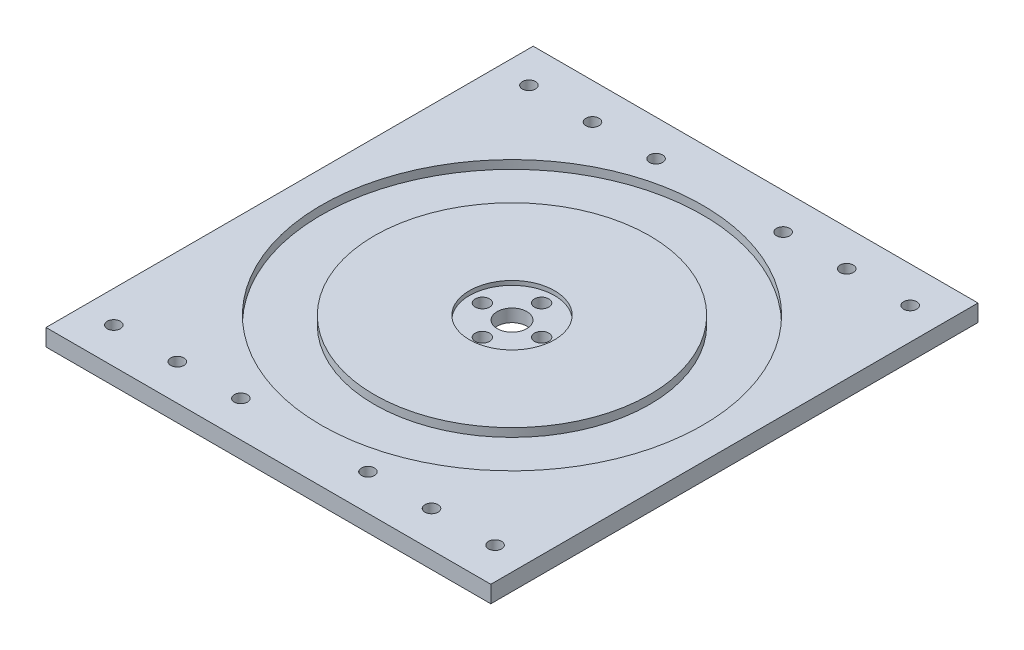
from build123d import *

# Parameters (mm, degrees)
SKETCH_1_W               = 105
SKETCH_1_H               = 115
SKETCH_1_R               = 3.5
SKETCH_1_R_2             = 1.55
EXTRUDE_1_DEPTH          = 4
SKETCH_2_R               = 45
SKETCH_2_R_2             = 32.5
CUT_EXTRUDE_1_DEPTH      = 2
SKETCH_3_R               = 10.05
SKETCH_3_R_2             = 1.7
CUT_EXTRUDE_2_DEPTH      = 1
CUT_EXTRUDE_5_DEPTH      = 20
CUT_EXTRUDE_5_DEPTH_BACK = 20
SKETCH_4_R               = 1.7


with BuildPart() as part:
    # 草图1 → 凸台-拉伸1 (new body)
    with BuildSketch(Plane(origin=(0, 0, 0), x_dir=(1, 0, 0), z_dir=(0, 1, 0))):
        Rectangle(SKETCH_1_W, SKETCH_1_H)
        with Locations(Location((0, 0, 0), (0, 0, 270))):
            Circle(SKETCH_1_R, mode=Mode.SUBTRACT)
        with Locations(Location((45, 49, 0), (0, 0, 270))):
            Circle(SKETCH_1_R_2, mode=Mode.SUBTRACT)
        with Locations(Location((45, -49, 0), (0, 0, 90))):
            Circle(SKETCH_1_R_2, mode=Mode.SUBTRACT)
        with Locations(Location((-45, -49, 0), (0, 0, 270))):
            Circle(SKETCH_1_R_2, mode=Mode.SUBTRACT)
        with Locations(Location((-45, 49, 0), (0, 0, 90))):
            Circle(SKETCH_1_R_2, mode=Mode.SUBTRACT)
        with Locations(Location((-15, -49, 0), (0, 0, 270))):
            Circle(SKETCH_1_R_2, mode=Mode.SUBTRACT)
        with Locations(Location((15, -49, 0), (0, 0, 90))):
            Circle(SKETCH_1_R_2, mode=Mode.SUBTRACT)
        with Locations(Location((15, 49, 0), (0, 0, 270))):
            Circle(SKETCH_1_R_2, mode=Mode.SUBTRACT)
        with Locations(Location((-15, 49, 0), (0, 0, 90))):
            Circle(SKETCH_1_R_2, mode=Mode.SUBTRACT)
        with Locations(Location((30, 49, 0), (0, 0, 270))):
            Circle(SKETCH_1_R_2, mode=Mode.SUBTRACT)
        with Locations(Location((-30, 49, 0), (0, 0, 270))):
            Circle(SKETCH_1_R_2, mode=Mode.SUBTRACT)
        with Locations(Location((-30, -49, 0), (0, 0, 270))):
            Circle(SKETCH_1_R_2, mode=Mode.SUBTRACT)
        with Locations(Location((30, -49, 0), (0, 0, 270))):
            Circle(SKETCH_1_R_2, mode=Mode.SUBTRACT)
    extrude(amount=EXTRUDE_1_DEPTH)

    # 草图2 → 切除-拉伸1 (cut)
    with BuildSketch(Plane(origin=(0, 4, 0), x_dir=(1, 0, 0), z_dir=(0, 1, 0))):
        with Locations(Location((0, 0, 0), (0, 0, 270))):
            Circle(SKETCH_2_R)
        with Locations(Location((0, 0, 0), (0, 0, 270))):
            Circle(SKETCH_2_R_2, mode=Mode.SUBTRACT)
    extrude(amount=-CUT_EXTRUDE_1_DEPTH, mode=Mode.SUBTRACT)

    # 草图3 → 切除-拉伸2 (cut)
    with BuildSketch(Plane(origin=(0, 4, 0), x_dir=(1, 0, 0), z_dir=(0, 1, 0))):
        with Locations(Location((0, 0, 0), (0, 0, 270))):
            Circle(SKETCH_3_R)
        with Locations(Location((0, 7, 0), (0, 0, 270))):
            Circle(SKETCH_3_R_2, mode=Mode.SUBTRACT)
        with Locations(Location((7, 0, 0), (0, 0, 270))):
            Circle(SKETCH_3_R_2, mode=Mode.SUBTRACT)
        with Locations(Location((0, -7, 0), (0, 0, 270))):
            Circle(SKETCH_3_R_2, mode=Mode.SUBTRACT)
        with Locations(Location((-7, 0, 0), (0, 0, 270))):
            Circle(SKETCH_3_R_2, mode=Mode.SUBTRACT)
    extrude(amount=-CUT_EXTRUDE_2_DEPTH, mode=Mode.SUBTRACT)

    # 草图4 → 切除-拉伸5 (cut, two sides: drawn at the far end of the back side and taken through both)
    with BuildSketch(Plane(origin=(0, 3, 0), x_dir=(1, 0, 0), z_dir=(0, 1, 0)).offset(-CUT_EXTRUDE_5_DEPTH_BACK)):
        with Locations(Location((7, 0, 0), (0, 0, 90))):
            Circle(SKETCH_4_R)
        with Locations(Location((0, 7, 0), (0, 0, 90))):
            Circle(SKETCH_4_R)
        with Locations(Location((0, -7, 0), (0, 0, 90))):
            Circle(SKETCH_4_R)
        with Locations(Location((-7, 0, 0), (0, 0, 90))):
            Circle(SKETCH_4_R)
    extrude(amount=CUT_EXTRUDE_5_DEPTH + CUT_EXTRUDE_5_DEPTH_BACK, mode=Mode.SUBTRACT)


solid = part.part
